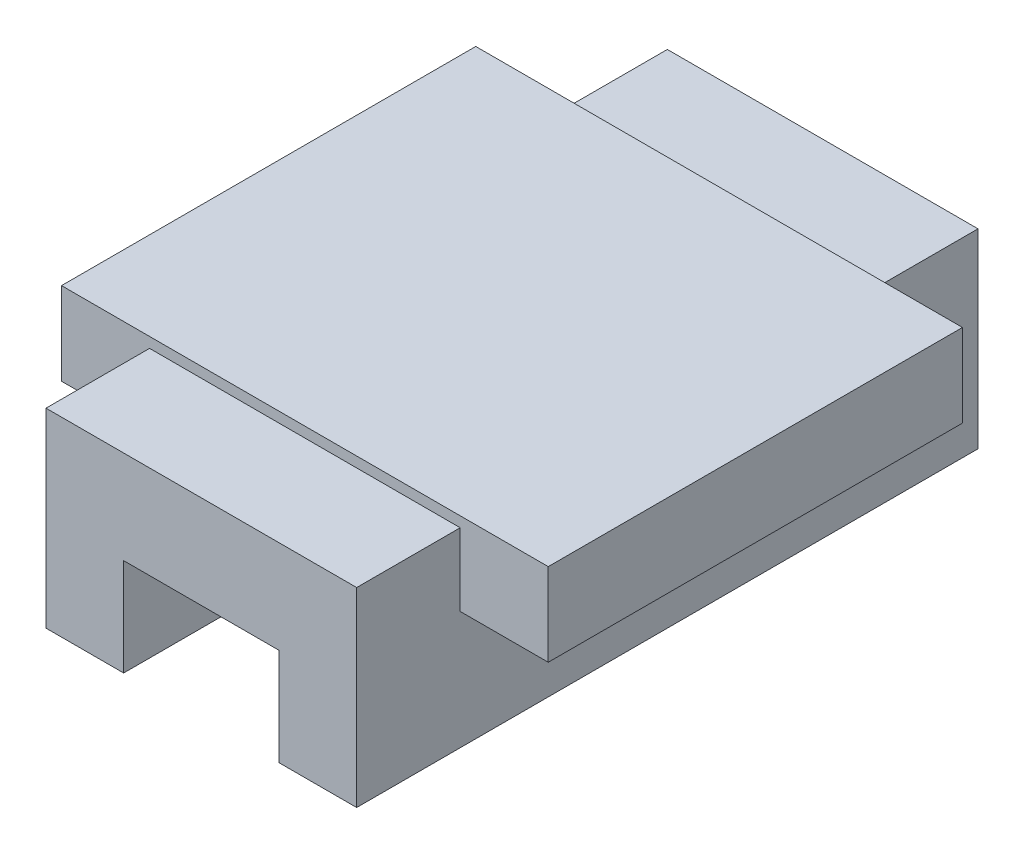
from build123d import *

# Parameters (mm, degrees)
BOSS_EXTRUDE1_DEPTH = 30
BOSS_EXTRUDE2_DEPTH = 20


with BuildPart() as part:
    # Sketch1 → Boss-Extrude1 (new, symmetric)
    with BuildSketch(Plane.XY):
        Polygon((7.5, 7), (7.5, -2.4), (15, -2.4), (15, 16), (-15, 16), (-15, -2.4), (-7.5, -2.4), (-7.5, 7), align=None)
    extrude(amount=BOSS_EXTRUDE1_DEPTH, both=True)

    # Sketch1<3> → Boss-Extrude2 (add, symmetric)
    with BuildSketch(Plane.XY):
        Polygon((15, 16), (15, 9), (23.5, 9), (23.5, 17), (-23.5, 17), (-23.5, 9), (-15, 9), (-15, 16), align=None)
    extrude(amount=BOSS_EXTRUDE2_DEPTH, both=True)


solid = part.part
